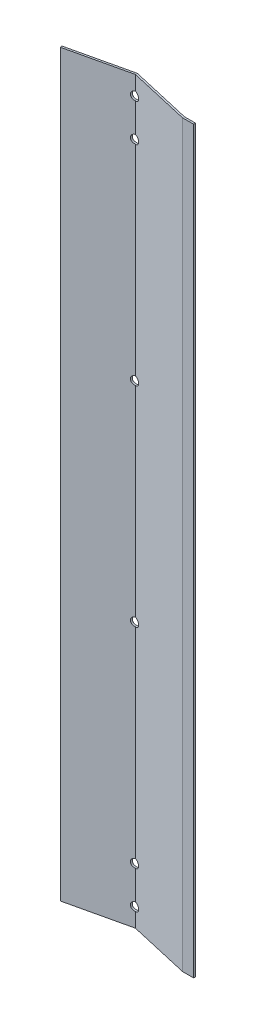
from build123d import *

# Parameters (mm, degrees)
BOSS_EXTRUDE1_DEPTH     = 1975
CUT_EXTRUDE1_DEPTH      = 2156.921715736
CUT_EXTRUDE1_DEPTH_BACK = 2156.921715736
SKETCH2_R               = 11


with BuildPart() as part:
    # Sketch1 → Boss-Extrude1 (new body)
    with BuildSketch(Plane(origin=(0, 0, 0), x_dir=(1, 0, 0), z_dir=(0, 1, 0))):
        Polygon((-506.627585227, -999.704780497), (-536.627585227, -999.704780497), (-699.627585227, -962.343755534), (-862.627585227, -999.704780497), (-863.694836689, -994.820010869), (-699.627585227, -957.225806909), (-536.087738826, -994.704780497), (-506.627585227, -994.704780497), align=None)
    extrude(amount=BOSS_EXTRUDE1_DEPTH)

    # Sketch2 → Cut-Extrude1 (cut, two sides: drawn at the far end of the back side and taken through both)
    with BuildSketch(Plane(origin=(0, 0, 994.704780497), x_dir=(-1, 0, 0), z_dir=(0, 0, -1)).offset(-CUT_EXTRUDE1_DEPTH_BACK)):
        with Locations(Location((699.627585227, 1925, 0), (0, 0, 90))):
            Circle(SKETCH2_R)
        with Locations(Location((699.627585227, 1825, 0), (0, 0, 90))):
            Circle(SKETCH2_R)
        with Locations(Location((699.627585227, 50, 0), (0, 0, 270))):
            Circle(SKETCH2_R)
        with Locations(Location((699.627585227, 150, 0), (0, 0, 90))):
            Circle(SKETCH2_R)
        with Locations(Location((699.627585227, 708.333, 0), (0, 0, 90))):
            Circle(SKETCH2_R)
        with Locations(Location((699.627585227, 1266.66633, 0), (0, 0, 90))):
            Circle(SKETCH2_R)
    extrude(amount=CUT_EXTRUDE1_DEPTH + CUT_EXTRUDE1_DEPTH_BACK, mode=Mode.SUBTRACT)


solid = part.part
